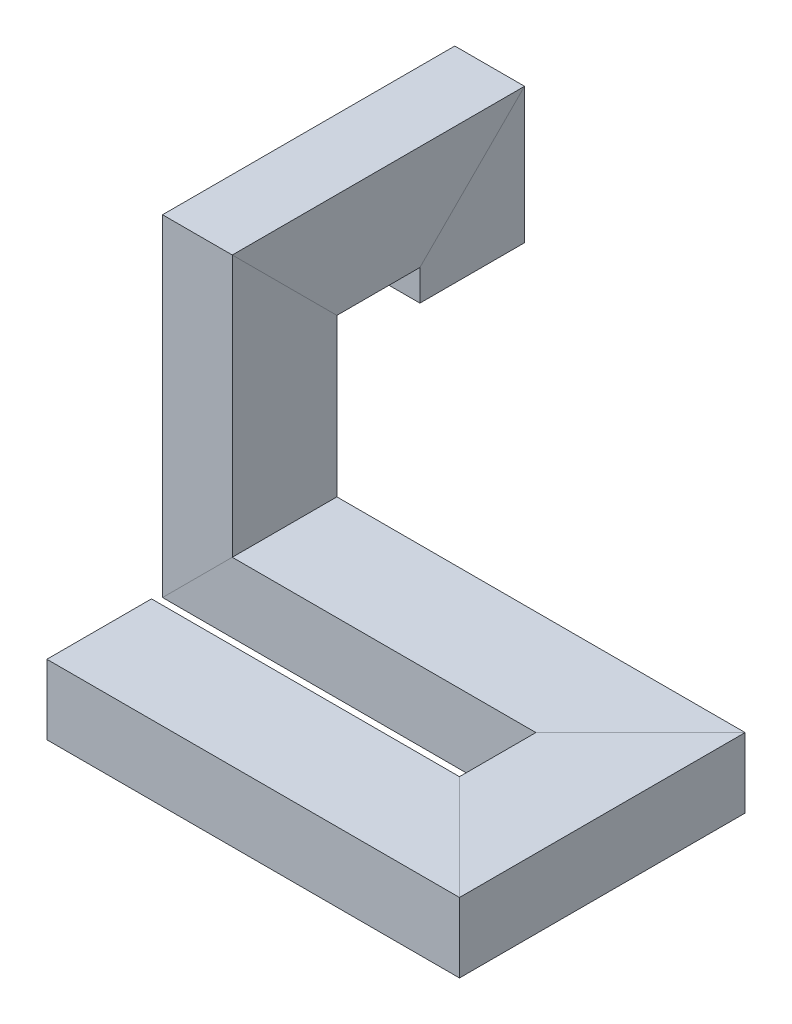
from build123d import *

# Parameters (mm, degrees)
SKETCH2_W = 17.145
SKETCH2_H = 11.43


with BuildPart() as part:
    # Sweep1: sweep along a curve in space
    with BuildLine() as sweep1_path:
        Line((0, 0, 0), (59.052587147, 0, 0))
        Line((59.052587147, 0, 0), (59.052587147, 0, -29.66875879))
        Line((59.052587147, 0, -29.66875879), (-4.996664108, 0, -29.66875879))
        Line((-4.996664108, 0, -29.66875879), (-4.996664108, 40.045617421, -29.66875879))
        Line((-4.996664108, 40.045617421, -29.66875879), (-4.996664108, 40.045617421, -60.422953943))
        Line((-4.996664108, 40.045617421, -60.422953943), (-4.996664108, 26.405396034, -60.422953943))
    # Sketch2 → Sweep1 (sweep)
    with BuildSketch(Plane(origin=(0, 0, 0), x_dir=(0, 0, -1), z_dir=(1, 0, 0))):
        Rectangle(SKETCH2_W, SKETCH2_H)
    sweep(path=sweep1_path.line, transition=Transition.RIGHT)


solid = part.part
